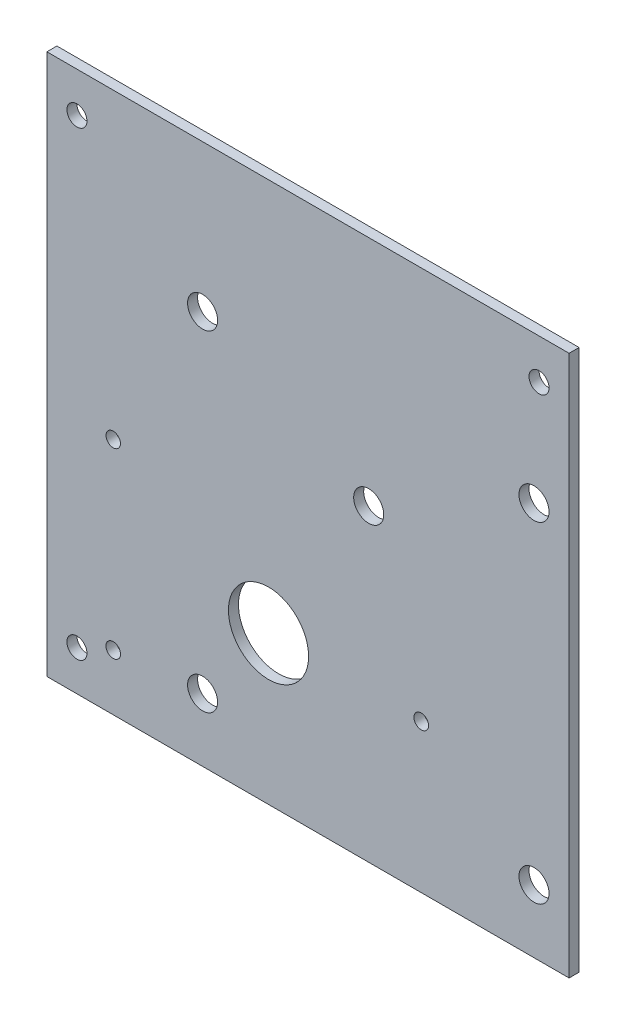
from build123d import *

# Parameters (mm, degrees)
SKETCH1_W           = 165.481
SKETCH1_H           = 171.45
SKETCH1_R           = 2.31775
SKETCH1_R_2         = 2.286
SKETCH1_R_3         = 12.7
SKETCH1_R_4         = 4.7625
BOSS_EXTRUDE1_DEPTH = 3.175
SKETCH2_R           = 3.175
CUT_EXTRUDE1_DEPTH  = 3.175


with BuildPart() as part:
    # Sketch1 → Boss-Extrude1 (new body)
    with BuildSketch(Plane.XY):
        with Locations((82.7405, 85.725)):
            Rectangle(SKETCH1_W, SKETCH1_H)
        with Locations((21.0185, 17.78)):
            Circle(SKETCH1_R, mode=Mode.SUBTRACT)
        with Locations((21.0185, 75.565)):
            Circle(SKETCH1_R_2, mode=Mode.SUBTRACT)
        with Locations((118.6307, 46.99)):
            Circle(SKETCH1_R, mode=Mode.SUBTRACT)
        with Locations((70.231, 46.99)):
            Circle(SKETCH1_R_3, mode=Mode.SUBTRACT)
        with Locations((101.981, 97.79)):
            Circle(SKETCH1_R_4, mode=Mode.SUBTRACT)
        with Locations((49.3395, 20.0025)):
            Circle(SKETCH1_R_4, mode=Mode.SUBTRACT)
        with Locations((49.3395, 124.7775)):
            Circle(SKETCH1_R_4, mode=Mode.SUBTRACT)
        with Locations((154.3685, 20.0025)):
            Circle(SKETCH1_R_4, mode=Mode.SUBTRACT)
        with Locations((154.3685, 124.7775)):
            Circle(SKETCH1_R_4, mode=Mode.SUBTRACT)
    extrude(amount=BOSS_EXTRUDE1_DEPTH)

    # Sketch2 → Cut-Extrude1 (cut)
    with BuildSketch(Plane.XY.offset(3.175)):
        with Locations((9.525, 158.75)):
            Circle(SKETCH2_R)
        with Locations((9.525, 12.7)):
            Circle(SKETCH2_R)
        with Locations((155.956, 158.75)):
            Circle(SKETCH2_R)
    extrude(amount=-CUT_EXTRUDE1_DEPTH, mode=Mode.SUBTRACT)


solid = part.part
